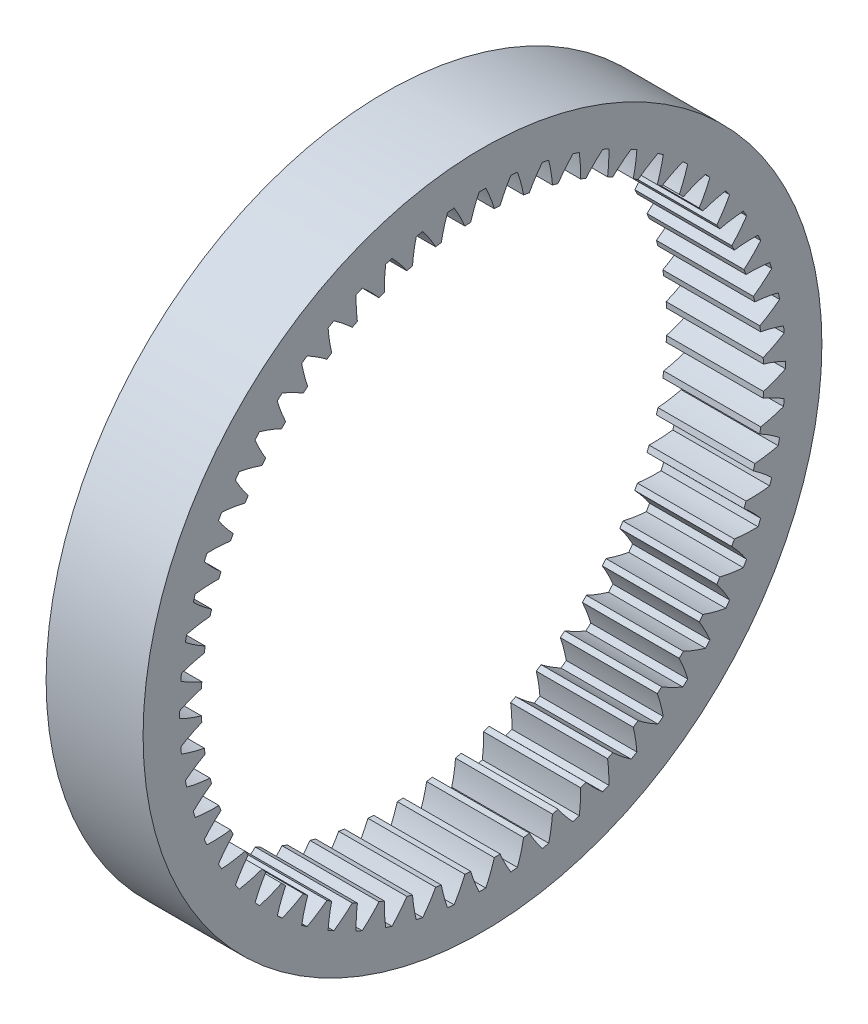
from build123d import *

# Parameters (mm, degrees)
BASPROSKE_W     = 10
BASPROSKE_H     = 6
TOOTHCUT_DEPTH  = 51.497524692
TEETHCUTS_COUNT = 60
TEETHCUTS_ANGLE = 354


with BuildPart() as part:
    # BasProSke → Base-Revolve (revolve)
    with BuildSketch(Plane(origin=(0, 0, 0), x_dir=(1, 0, 0), z_dir=(0, 1, 0)), mode=Mode.PRIVATE) as base_revolve_sk:
        with Locations((5, 32)):
            Rectangle(BASPROSKE_W, BASPROSKE_H)
    revolve(base_revolve_sk.sketch.rotate(Axis((-10, 0, 0), (1, 0, 0)), 180), axis=Axis((-10, 0, 0), (1, 0, 0)))

    # TooCutSke → ToothCut (cut, through all)
    with BuildSketch(Plane(origin=(0, 0, 0), x_dir=(0, 0, -1), z_dir=(1, 0, 0))):
        with BuildLine():
            ThreePointArc((1.227357706, 28.948593027), (0.830805794, 30.117149174), (0.339543276, 31.24915537))
            ThreePointArc((0.339543276, 31.24915537), (0, 31.251), (-0.339543276, 31.24915537))
            ThreePointArc((-0.339543276, 31.24915537), (-0.830805794, 30.117149174), (-1.227357706, 28.948593027))
            ThreePointArc((-1.227357706, 28.948593027), (0, 28.9746), (1.227357706, 28.948593027))
        make_face()
    toothcut = extrude(amount=TOOTHCUT_DEPTH, mode=Mode.SUBTRACT)

    # TeethCuts: ToothCut ×60 about axis
    teethcuts_axis = Axis((-10, 0, 0), (1, 0, 0))
    for i in range(1, TEETHCUTS_COUNT):
        add(toothcut.rotate(teethcuts_axis, i * TEETHCUTS_ANGLE / (TEETHCUTS_COUNT - 1)), mode=Mode.SUBTRACT)


solid = part.part
